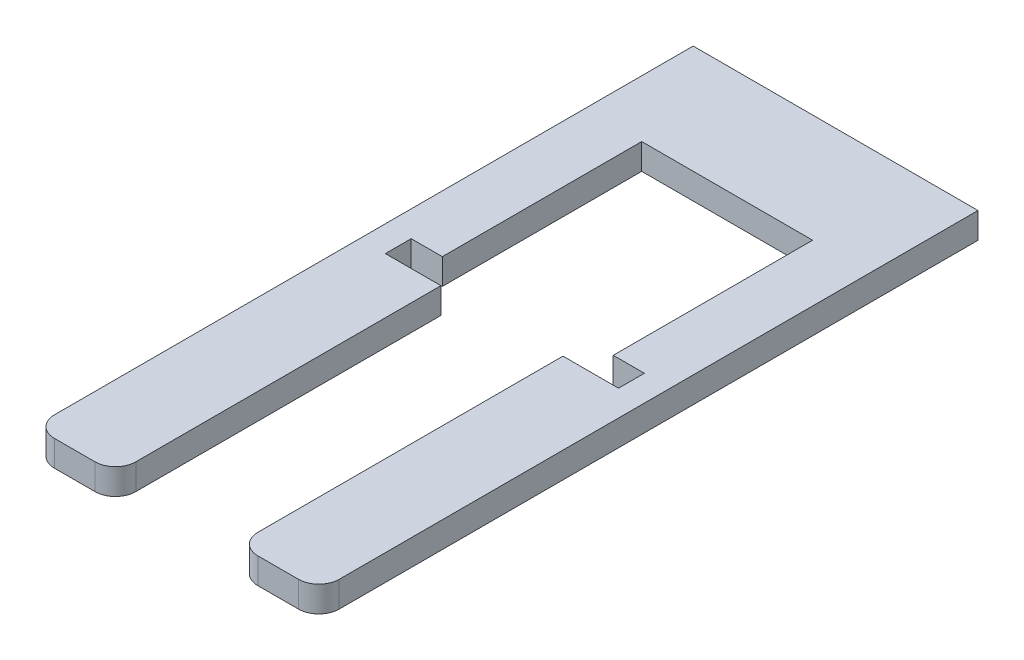
from build123d import *

# Parameters (mm, degrees)
BOSS_EXTRUDE1_DEPTH = 3.175
CUT_EXTRUDE1_DEPTH  = 204.138678001
SKETCH3_W           = 42
SKETCH3_H           = 55.35
SKETCH3_W_2         = 30
SKETCH3_H_2         = 80
SKETCH3_W_3         = 7.65
SKETCH3_H_3         = 6.35
CUT_EXTRUDE2_DEPTH  = 204.138678001
FILLET3_R           = 5


with BuildPart() as part:
    # Sketch1 → Boss-Extrude1 (new, symmetric)
    with BuildSketch(Plane(origin=(0, 0, 0), x_dir=(1, 0, 0), z_dir=(0, 1, 0))):
        with BuildLine():
            Line((35, -200), (35, 0))
            ThreePointArc((35, 0), (0, 35), (-35, 0))
            Line((-35, 0), (-35, -200))
            Line((-35, -200), (35, -200))
        make_face()
    extrude(amount=BOSS_EXTRUDE1_DEPTH, both=True)

    # Sketch2 → Cut-Extrude1 (cut, through all)
    with BuildSketch(Plane(origin=(0, 3.175, 0), x_dir=(1, 0, 0), z_dir=(0, 1, 0))):
        with BuildLine():
            Line((-35, -38), (35, -38))
            Line((35, -38), (35, 0))
            ThreePointArc((35, 0), (0, 35), (-35, 0))
            Line((-35, 0), (-35, -38))
        make_face()
    extrude(amount=-CUT_EXTRUDE1_DEPTH, mode=Mode.SUBTRACT)

    # Sketch3 → Cut-Extrude2 (cut, through all)
    with BuildSketch(Plane(origin=(0, 3.175, 0), x_dir=(1, 0, 0), z_dir=(0, 1, 0))):
        with Locations((0, -92.325)):
            Rectangle(SKETCH3_W, SKETCH3_H)
        with Locations((0, -160)):
            Rectangle(SKETCH3_W_2, SKETCH3_H_2)
        with Locations((-24.825, -116.825)):
            Rectangle(SKETCH3_W_3, SKETCH3_H_3)
        with Locations((24.825, -116.825)):
            Rectangle(SKETCH3_W_3, SKETCH3_H_3)
    extrude(amount=-CUT_EXTRUDE2_DEPTH, mode=Mode.SUBTRACT)

    # Fillet3
    fillet3_edges = [part.edges().sort_by_distance(p)[0] for p in [
        (15, 0, 200),
        (-15, 0, 200),
        (35, 0, 200),
        (-35, 0, 200),
    ]]
    fillet(fillet3_edges, radius=FILLET3_R)


solid = part.part
